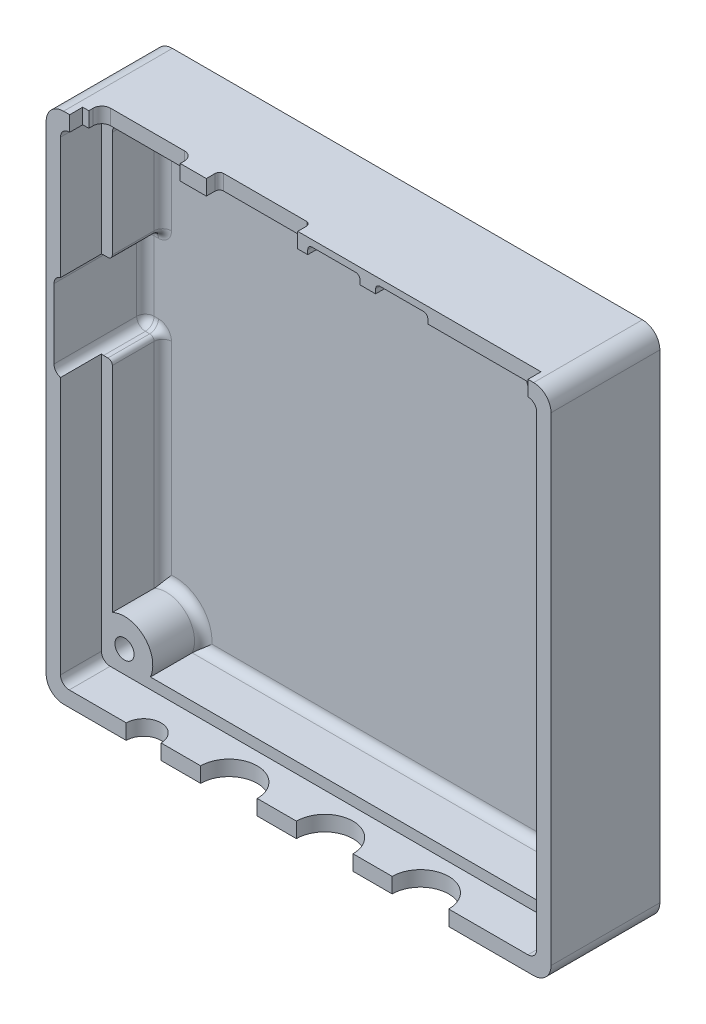
from build123d import *

# Parameters (mm, degrees)
GEH_USEKORPUS_DEPTH                = 12.5
GEH_USEAUSH_HLUNG_DEPTH            = 10.5
PLATINENHALTERUNG_DEPTH            = 4.7
SKETCH8_R                          = 1.1
SCHRAUBL_CHER_DEPTH                = 43.096199353
SCHRAUBENMUTTER_AUSNEHMUNGEN_DEPTH = 3
SKETCH10_R                         = 3.25
SKETCH10_R_2                       = 2
BUTTON_AUSNEHMUNGEN_DEPTH          = 3
SCHNITT_LINEAR_AUSTRAGEN1_DEPTH    = 10
SKIZZE2_W                          = 52.65
SKIZZE2_H                          = 1.75
SCHNITT_LINEAR_AUSTRAGEN2_DEPTH    = 1.5
SKIZZE3_W                          = 6
SKIZZE3_H                          = 1
SCHNITT_LINEAR_AUSTRAGEN3_DEPTH    = 1.5
VERRUNDUNG1_R                      = 0.5
VERRUNDUNG2_R                      = 1


with BuildPart() as part:
    # Sketch1 → Gehäusekorpus (new body)
    with BuildSketch(Plane.XY):
        with BuildLine():
            Line((-27, -29.5), (27, -29.5))
            ThreePointArc((27, -29.5), (28.414213562, -28.914213562), (29, -27.5))
            Line((29, -27.5), (29, 27.5))
            ThreePointArc((29, 27.5), (28.414213562, 28.914213562), (27, 29.5))
            Line((27, 29.5), (-27, 29.5))
            ThreePointArc((-27, 29.5), (-28.414213562, 28.914213562), (-29, 27.5))
            Line((-29, 27.5), (-29, -27.5))
            ThreePointArc((-29, -27.5), (-28.414213562, -28.914213562), (-27, -29.5))
        make_face()
    extrude(amount=GEH_USEKORPUS_DEPTH)

    # Sketch3 → Gehäuseaushöhlung (cut)
    with BuildSketch(Plane.XY.offset(12.5)):
        with BuildLine():
            Line((-25.1, 26.5), (21.721325798, 26.5))
            ThreePointArc((21.721325798, 26.5), (22.441099985, 22.863363374), (26.1, 22.266998125))
            Line((26.1, 22.266998125), (26.1, -25.5))
            ThreePointArc((26.1, -25.5), (25.807106781, -26.207106781), (25.1, -26.5))
            Line((25.1, -26.5), (-21.721325798, -26.5))
            ThreePointArc((-21.721325798, -26.5), (-22.441099985, -22.863363374), (-26.1, -22.266998125))
            Line((-26.1, -22.266998125), (-26.1, 2.3))
            ThreePointArc((-26.1, 2.3), (-26.246446609, 2.653553391), (-26.6, 2.8))
            Line((-26.6, 2.8), (-27.1, 2.8))
            ThreePointArc((-27.1, 2.8), (-27.807106781, 3.092893219), (-28.1, 3.8))
            Line((-28.1, 3.8), (-28.1, 11.8))
            ThreePointArc((-28.1, 11.8), (-27.807106781, 12.507106781), (-27.1, 12.8))
            Line((-27.1, 12.8), (-26.6, 12.8))
            ThreePointArc((-26.6, 12.8), (-26.246446609, 12.946446609), (-26.1, 13.3))
            Line((-26.1, 13.3), (-26.1, 25.5))
            ThreePointArc((-26.1, 25.5), (-25.807106781, 26.207106781), (-25.1, 26.5))
        make_face()
    extrude(amount=-GEH_USEAUSH_HLUNG_DEPTH, mode=Mode.SUBTRACT)

    # Sketch4 → Platinenhalterung (cut)
    with BuildSketch(Plane.XY.offset(12.5)):
        with BuildLine():
            Line((-26.35, 27.75), (26.35, 27.75))
            ThreePointArc((26.35, 27.75), (27.057106781, 27.457106781), (27.35, 26.75))
            Line((27.35, 26.75), (27.35, -26.75))
            ThreePointArc((27.35, -26.75), (27.057106781, -27.457106781), (26.35, -27.75))
            Line((26.35, -27.75), (-26.35, -27.75))
            ThreePointArc((-26.35, -27.75), (-27.057106781, -27.457106781), (-27.35, -26.75))
            Line((-27.35, -26.75), (-27.35, 26.75))
            ThreePointArc((-27.35, 26.75), (-27.057106781, 27.457106781), (-26.35, 27.75))
        make_face()
    extrude(amount=-PLATINENHALTERUNG_DEPTH, mode=Mode.SUBTRACT)

    # Sketch8 → Schraublöcher (cut, through all)
    with BuildSketch(Plane.XY.offset(7.8)):
        with Locations((-24.7, -25.2)):
            Circle(SKETCH8_R)
        with Locations((24.7, 25.2)):
            Circle(SKETCH8_R)
    extrude(amount=-SCHRAUBL_CHER_DEPTH, mode=Mode.SUBTRACT)

    # Sketch9 → Schraubenmutter_Ausnehmungen (cut)
    with BuildSketch(Plane.XY):
        Polygon((27.182606158, 25.2), (25.941303079, 27.35), (23.458696921, 27.35), (22.217393842, 25.2), (23.458696921, 23.05), (25.941303079, 23.05), align=None)
        Polygon((-22.217393842, -25.2), (-23.458696921, -23.05), (-25.941303079, -23.05), (-27.182606158, -25.2), (-25.941303079, -27.35), (-23.458696921, -27.35), align=None)
    extrude(amount=SCHRAUBENMUTTER_AUSNEHMUNGEN_DEPTH, mode=Mode.SUBTRACT)

    # Sketch10 → Button_Ausnehmungen (cut)
    with BuildSketch(Plane.XZ.offset(29.5)):
        with Locations((-8, 12.5)):
            Circle(SKETCH10_R)
        with Locations((3, 12.5)):
            Circle(SKETCH10_R)
        with Locations((14, 12.5)):
            Circle(SKETCH10_R)
        with Locations((-17.8, 12.5)):
            Circle(SKETCH10_R_2)
    extrude(amount=-BUTTON_AUSNEHMUNGEN_DEPTH, mode=Mode.SUBTRACT)

    # Skizze1 → Schnitt-Linear austragen1 (cut)
    with BuildSketch(Plane(origin=(0, 29.5, 0), x_dir=(1, 0, 0), z_dir=(0, 1, 0))):
        with BuildLine():
            Line((-15.1, -12.5), (-25.6, -12.5))
            Line((-25.6, -12.5), (-25.6, -10.5))
            ThreePointArc((-25.6, -10.5), (-25.307106781, -9.792893219), (-24.6, -9.5))
            Line((-24.6, -9.5), (-16.1, -9.5))
            ThreePointArc((-16.1, -9.5), (-15.392893219, -9.792893219), (-15.1, -10.5))
            Line((-15.1, -10.5), (-15.1, -12.5))
        make_face()
        with BuildLine():
            Line((-12.1, -12.5), (-1.6, -12.5))
            Line((-1.6, -12.5), (-1.6, -10))
            ThreePointArc((-1.6, -10), (-1.746446609, -9.646446609), (-2.1, -9.5))
            Line((-2.1, -9.5), (-11.6, -9.5))
            ThreePointArc((-11.6, -9.5), (-11.953553391, -9.646446609), (-12.1, -10))
            Line((-12.1, -10), (-12.1, -12.5))
        make_face()
    extrude(amount=-SCHNITT_LINEAR_AUSTRAGEN1_DEPTH, mode=Mode.SUBTRACT)

    # Skizze2 → Schnitt-Linear austragen2 (cut)
    with BuildSketch(Plane.XY.offset(12.5)):
        with Locations((0.025, 28.625)):
            Rectangle(SKIZZE2_W, SKIZZE2_H)
    extrude(amount=-SCHNITT_LINEAR_AUSTRAGEN2_DEPTH, mode=Mode.SUBTRACT)

    # Skizze3 → Schnitt-Linear austragen3 (cut)
    with BuildSketch(Plane.XY.offset(11)):
        with Locations((2.55, 28.25)):
            Rectangle(SKIZZE3_W, SKIZZE3_H)
        with Locations((10.35, 28.25)):
            Rectangle(SKIZZE3_W, SKIZZE3_H)
    extrude(amount=-SCHNITT_LINEAR_AUSTRAGEN3_DEPTH, mode=Mode.SUBTRACT)

    # Verrundung1
    verrundung1_edges = [part.edges().sort_by_distance(p)[0] for p in [
        (-0.45, 28.25, 9.5),
        (2.55, 28.75, 9.5),
        (-0.45, 28.75, 10.25),
        (5.55, 28.25, 9.5),
        (5.55, 28.75, 10.25),
        (7.35, 28.25, 9.5),
        (10.35, 28.75, 9.5),
        (7.35, 28.75, 10.25),
        (13.35, 28.25, 9.5),
        (13.35, 28.75, 10.25),
    ]]
    fillet(verrundung1_edges, radius=VERRUNDUNG1_R)

    # Verrundung2
    verrundung2_edges = [part.edges().sort_by_distance(p)[0] for p in [
        (-22.441099985, -22.863363374, 2),
        (-26.1, -9.983499062, 2),
        (-26.246446609, 2.653553391, 2),
        (-26.85, 2.8, 2),
        (-27.807106781, 3.092893219, 2),
        (-28.1, 7.8, 2),
        (-27.807106781, 12.507106781, 2),
        (-26.85, 12.8, 2),
        (-26.246446609, 12.946446609, 2),
        (-26.1, 19.4, 2),
        (-25.807106781, 26.207106781, 2),
        (-1.689337101, 26.5, 2),
        (22.441099985, 22.863363374, 2),
        (26.1, -1.616500938, 2),
        (25.807106781, -26.207106781, 2),
        (1.689337101, -26.5, 2),
    ]]
    fillet(verrundung2_edges, radius=VERRUNDUNG2_R)


solid = part.part
